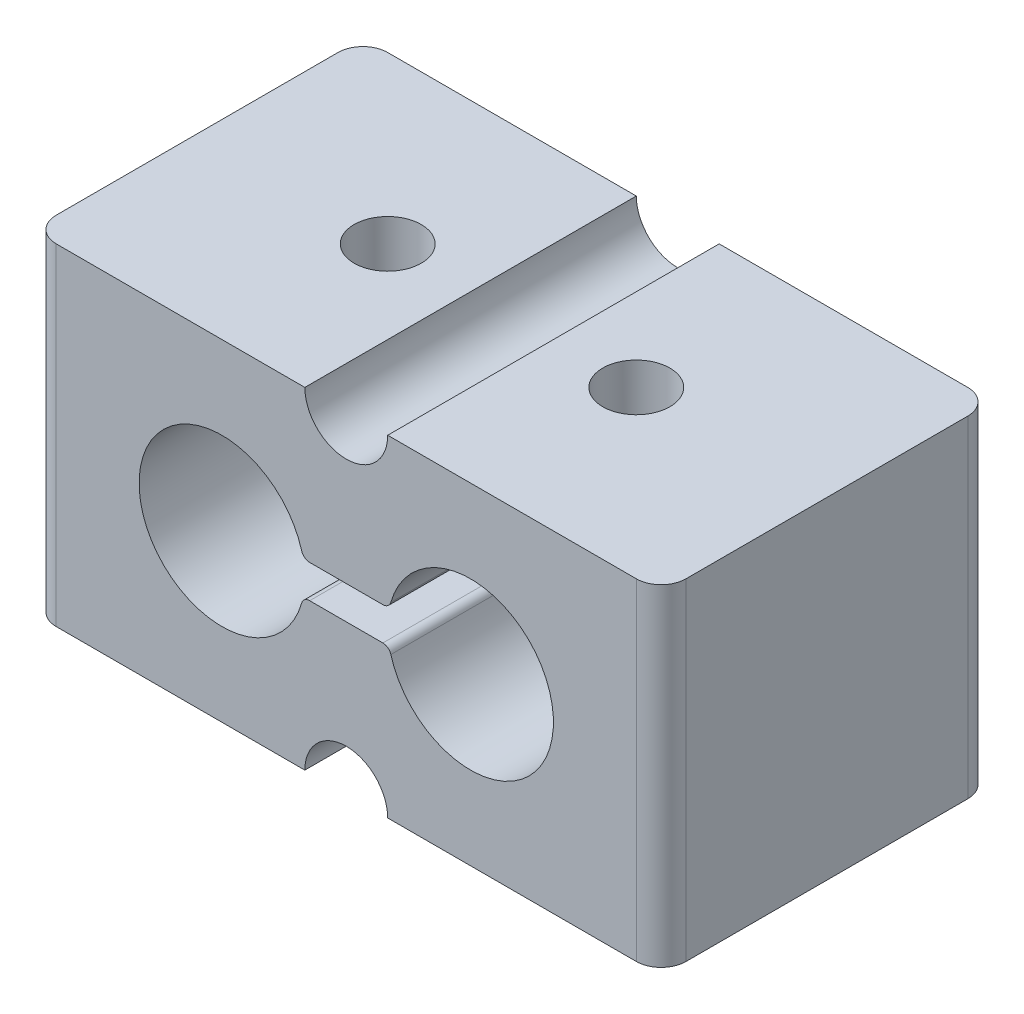
from build123d import *

# Parameters (mm, degrees)
SKETCH_1_W          = 38
SKETCH_1_H          = 20
EXTRUDE_1_DEPTH     = 10
SKETCH_2_R          = 2.025
CUT_EXTRUDE_1_DEPTH = 30.342801502
FILLET_1_R          = 0.5
SKETCH_3_R          = 2.5
CUT_EXTRUDE_2_DEPTH = 30.342801604
FILLET_2_R          = 1.5


with BuildPart() as part:
    # 草图1 → 凸台-拉伸1 (new, symmetric)
    with BuildSketch(Plane.XY):
        Rectangle(SKETCH_1_W, SKETCH_1_H)
        with BuildLine():
            Line((2.601020514, 1), (-2.601020514, 1))
            ThreePointArc((-2.601020514, 1), (-12.5, 0), (-2.601020514, -1))
            Line((-2.601020514, -1), (2.601020514, -1))
            ThreePointArc((2.601020514, -1), (12.5, 0), (2.601020514, 1))
        make_face(mode=Mode.SUBTRACT)
    extrude(amount=EXTRUDE_1_DEPTH, both=True)

    # 草图2 → 切除-拉伸1 (cut, through all)
    with BuildSketch(Plane(origin=(0, 10, 0), x_dir=(1, 0, 0), z_dir=(0, 1, 0))):
        with Locations(Location((-7.5, 0, 0), (0, 0, 180))):
            Circle(SKETCH_2_R)
        with Locations(Location((7.5, 0, 0), (0, 0, 180))):
            Circle(SKETCH_2_R)
    extrude(amount=-CUT_EXTRUDE_1_DEPTH, mode=Mode.SUBTRACT)

    # 圆角1
    fillet_1_edges = [part.edges().sort_by_distance(p)[0] for p in [
        (2.601020514, -1, 0),
        (2.601020514, 1, 0),
        (-2.601020514, 1, 0),
        (-2.601020514, -1, 0),
    ]]
    fillet(fillet_1_edges, radius=FILLET_1_R)

    # 草图3 → 切除-拉伸2 (cut, through all)
    with BuildSketch(Plane.XY.offset(10)):
        with Locations((0, 10)):
            Circle(SKETCH_3_R)
        with Locations((0, -10)):
            Circle(SKETCH_3_R)
    extrude(amount=-CUT_EXTRUDE_2_DEPTH, mode=Mode.SUBTRACT)

    # 圆角2
    fillet_2_edges = [part.edges().sort_by_distance(p)[0] for p in [
        (19, 0, 10),
        (-19, 0, 10),
        (19, 0, -10),
        (-19, 0, -10),
    ]]
    fillet(fillet_2_edges, radius=FILLET_2_R)


solid = part.part
